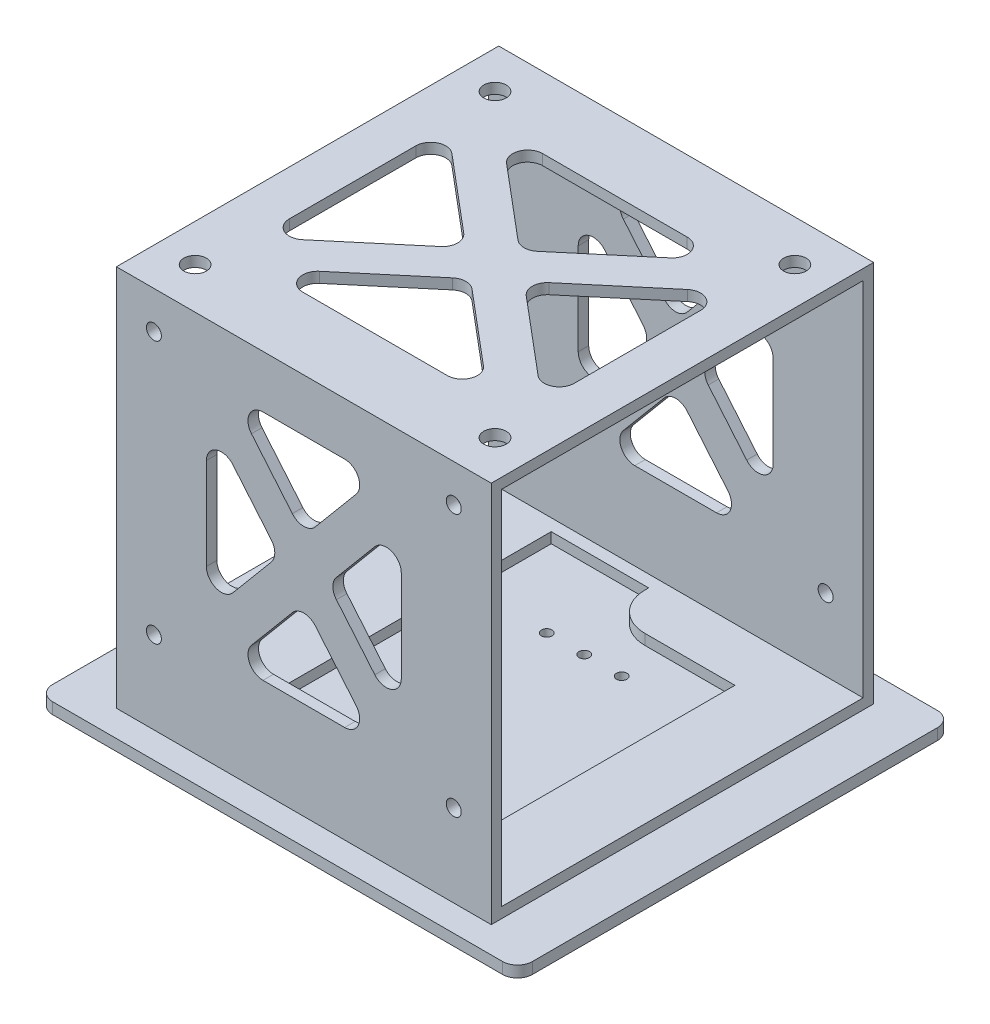
from build123d import *

# Parameters (mm, degrees)
ESBO_O1_W                = 51
ESBO_O1_H                = 51
ESBO_O1_W_2              = 48.2
ESBO_O1_H_2              = 48.2
RESSALTO_EXTRUS_O1_DEPTH = 50
ESBO_O2_W                = 58
ESBO_O2_H                = 64
RESSALTO_EXTRUS_O2_DEPTH = 1.5
ESBO_O3_R                = 1.5
CORTE_EXTRUS_O1_DEPTH    = 1.5
FILETE1_R                = 2
ESBO_O4_R                = 1
CORTE_EXTRUS_O2_DEPTH    = 84.356163539
FILETE2_R                = 2
CORTE_EXTRUS_O3_START    = 48.2
CORTE_EXTRUS_O3_DEPTH    = 1.4
ESBO_O7_R                = 0.7
CORTE_EXTRUS_O4_DEPTH    = 10
FILETE3_R                = 2


with BuildPart() as part:
    # Esboço1 → Ressalto-extrusão1 (new body)
    with BuildSketch(Plane(origin=(0, 0, 0), x_dir=(0, -1, 0), z_dir=(1, 0, 0))):
        Rectangle(ESBO_O1_W, ESBO_O1_H)
        Rectangle(ESBO_O1_W_2, ESBO_O1_H_2, mode=Mode.SUBTRACT)
    extrude(amount=RESSALTO_EXTRUS_O1_DEPTH)

    # Esboço3 → Corte-extrusão1 (cut)
    with BuildSketch(Plane(origin=(0, 25.5, 0), x_dir=(0, 0, -1), z_dir=(0, -1, 0))):
        Polygon((16, 40.118830516), (3.26835325, 25), (16, 9.881169484), align=None)
        Polygon((0, 28.881169484), (12.73164675, 44), (-12.73164675, 44), align=None)
        Polygon((-16, 9.881169484), (-3.26835325, 25), (-16, 40.118830516), align=None)
        Polygon((12.73164675, 6), (0, 21.118830516), (-12.73164675, 6), align=None)
        with Locations(Location((20, 5, 0), (0, 0, 180))):
            Circle(ESBO_O3_R)
        with Locations(Location((-20, 5, 0), (0, 0, 180))):
            Circle(ESBO_O3_R)
        with Locations(Location((-20, 45, 0), (0, 0, 180))):
            Circle(ESBO_O3_R)
        with Locations(Location((20, 45, 0), (0, 0, 180))):
            Circle(ESBO_O3_R)
    extrude(amount=CORTE_EXTRUS_O1_DEPTH, mode=Mode.SUBTRACT)

    # Filete1
    filete1_edges = [part.edges().sort_by_distance(p)[0] for p in [
        (6, 24.8, -12.73164675),
        (21.118830516, 24.8, 0),
        (6, 24.8, 12.73164675),
        (28.881169484, 24.8, 0),
        (44, 24.8, -12.73164675),
        (44, 24.8, 12.73164675),
        (25, 24.8, 3.26835325),
        (40.118830516, 24.8, 16),
        (9.881169484, 24.8, 16),
        (40.118830516, 24.8, -16),
        (25, 24.8, -3.26835325),
        (9.881169484, 24.8, -16),
    ]]
    fillet(filete1_edges, radius=FILETE1_R)

    # Esboço4 → Corte-extrusão2 (cut, through all)
    with BuildSketch(Plane.XY.offset(-25.5)):
        Polygon((34.737108335, -12.5), (25, -0.890370832), (15.262891665, -12.5), align=None)
        Polygon((12, -8.609629168), (21.737108335, 3), (12, 14.609629168), align=None)
        Polygon((25, 6.890370832), (34.737108335, 18.5), (15.262891665, 18.5), align=None)
        Polygon((38, -8.609629168), (38, 14.609629168), (28.262891665, 3), align=None)
        with Locations(Location((45, -14.5, 0), (0, 0, 180))):
            Circle(ESBO_O4_R)
        with Locations(Location((5, -14.5, 0), (0, 0, 180))):
            Circle(ESBO_O4_R)
        with Locations(Location((5, 20.5, 0), (0, 0, 180))):
            Circle(ESBO_O4_R)
        with Locations(Location((45, 20.5, 0), (0, 0, 180))):
            Circle(ESBO_O4_R)
    extrude(amount=CORTE_EXTRUS_O2_DEPTH, mode=Mode.SUBTRACT)

    # Filete2
    filete2_edges = [part.edges().sort_by_distance(p)[0] for p in [
        (38, 14.609629168, 24.8),
        (28.262891665, 3, 24.8),
        (38, -8.609629168, 24.8),
        (38, 14.609629168, -24.8),
        (28.262891665, 3, -24.8),
        (38, -8.609629168, -24.8),
        (21.737108335, 3, 24.8),
        (12, 14.609629168, 24.8),
        (12, -8.609629168, 24.8),
        (21.737108335, 3, -24.8),
        (12, 14.609629168, -24.8),
        (12, -8.609629168, -24.8),
        (25, 6.890370832, 24.8),
        (34.737108335, 18.5, 24.8),
        (15.262891665, 18.5, 24.8),
        (25, 6.890370832, -24.8),
        (34.737108335, 18.5, -24.8),
        (15.262891665, 18.5, -24.8),
        (34.737108335, -12.5, 24.8),
        (25, -0.890370832, 24.8),
        (15.262891665, -12.5, 24.8),
        (34.737108335, -12.5, -24.8),
        (25, -0.890370832, -24.8),
        (15.262891665, -12.5, -24.8),
    ]]
    fillet(filete2_edges, radius=FILETE2_R)

    # Esboço6 → Corte-extrusão3 (cut)
    with BuildSketch(Plane(origin=(0, 24.1, 0), x_dir=(0, 0, -1), z_dir=(0, -1, 0)).offset(CORTE_EXTRUS_O3_START)):
        with BuildLine():
            Line((-17, 40), (17, 40))
            Line((17, 40), (17, 28))
            ThreePointArc((17, 28), (18.464466094, 24.464466094), (22, 23))
            Line((22, 23), (22.5, 23))
            Line((22.5, 23), (22.5, 10))
            Line((22.5, 10), (-22.5, 10))
            Line((-22.5, 10), (-22.5, 23))
            Line((-22.5, 23), (-22, 23))
            ThreePointArc((-22, 23), (-18.464466094, 24.464466094), (-17, 28))
            Line((-17, 28), (-17, 40))
        make_face()
    extrude(amount=CORTE_EXTRUS_O3_DEPTH, mode=Mode.SUBTRACT)


with BuildPart() as body_2:
    # Esboço2 → Ressalto-extrusão2 (new body)
    with BuildSketch(Plane.ZX.offset(-25.5)):
        with Locations((0, 25)):
            Rectangle(ESBO_O2_W, ESBO_O2_H)
    extrude(amount=-RESSALTO_EXTRUS_O2_DEPTH)

    # Esboço7 → Corte-extrusão4 (cut)
    with BuildSketch(Plane.XZ.offset(27)):
        with Locations(Location((20, 11.9, 0), (0, 0, 270))):
            Circle(ESBO_O7_R)
        with Locations(Location((30, 11.9, 0), (0, 0, 270))):
            Circle(ESBO_O7_R)
        with Locations(Location((30, -11.9, 0), (0, 0, 270))):
            Circle(ESBO_O7_R)
        with Locations(Location((20, -11.9, 0), (0, 0, 270))):
            Circle(ESBO_O7_R)
        with Locations(Location((25, -11.9, 0), (0, 0, 270))):
            Circle(ESBO_O7_R)
        with Locations(Location((25, 11.9, 0), (0, 0, 270))):
            Circle(ESBO_O7_R)
    extrude(amount=-CORTE_EXTRUS_O4_DEPTH, mode=Mode.SUBTRACT)

    # Filete3
    filete3_edges = [body_2.edges().sort_by_distance(p)[0] for p in [
        (57, -26.25, -29),
        (57, -26.25, 29),
        (-7, -26.25, 29),
        (-7, -26.25, -29),
    ]]
    fillet(filete3_edges, radius=FILETE3_R)


solid = Compound([part.part, body_2.part])
